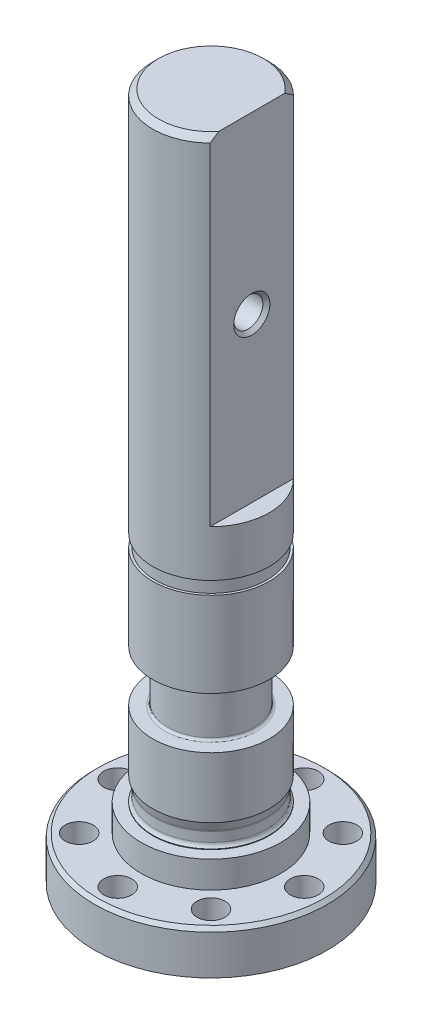
from build123d import *

# Parameters (mm, degrees)
SCHIZZO1_R                   = 10
SCHIZZO1_R_2                 = 1.2
ESTRUSIONE_ESTRUSIONE1_DEPTH = 6
SCHIZZO2_R                   = 5
ESTRUSIONE_ESTRUSIONE2_DEPTH = 53
SCHIZZO9_W                   = 4
SCHIZZO9_H                   = 2.3
SMUSSO3_SIZE                 = 0.3
FORO_8_1_8_1_1_D             = 8.1
FORO_8_1_8_1_1_DEPTH         = 2
FORO_8_1_8_1_1_TIP           = 2.433485507
SMUSSO5_SIZE                 = 0.5
TAGLIO_ESTRUSIONE1_START     = -29
TAGLIO_ESTRUSIONE1_DEPTH     = 29
PREFORO_DA_MASCHIARE_M3_1_D  = 2.5
SMUSSO4_SIZE                 = 0.3
FORO_8_1_8_1_2_D             = 8.1
FORO_8_1_8_1_2_DEPTH         = 2.5
FORO_8_1_8_1_2_TIP           = 2.433485507
SCHIZZO17_W                  = 1.3
SCHIZZO17_H                  = 4.4
RACCORDO1_R                  = 0.2
SCHIZZO18_W                  = 0.2
SCHIZZO18_H                  = 1.1


with BuildPart() as part:
    # Schizzo1 → Estrusione-Estrusione1 (new body)
    with BuildSketch(Plane(origin=(0, 0, 0), x_dir=(1, 0, 0), z_dir=(0, 1, 0))):
        with Locations(Location((0, 0, 0), (0, 0, 270))):
            Circle(SCHIZZO1_R)
        with Locations(Location((0, 8, 0), (0, 0, 270))):
            Circle(SCHIZZO1_R_2, mode=Mode.SUBTRACT)
        with Locations(Location((5.656854249, 5.656854249, 0), (0, 0, 270))):
            Circle(SCHIZZO1_R_2, mode=Mode.SUBTRACT)
        with Locations(Location((8, 0, 0), (0, 0, 270))):
            Circle(SCHIZZO1_R_2, mode=Mode.SUBTRACT)
        with Locations(Location((5.656854249, -5.656854249, 0), (0, 0, 270))):
            Circle(SCHIZZO1_R_2, mode=Mode.SUBTRACT)
        with Locations(Location((0, -8, 0), (0, 0, 270))):
            Circle(SCHIZZO1_R_2, mode=Mode.SUBTRACT)
        with Locations(Location((-5.656854249, -5.656854249, 0), (0, 0, 270))):
            Circle(SCHIZZO1_R_2, mode=Mode.SUBTRACT)
        with Locations(Location((-8, 0, 0), (0, 0, 270))):
            Circle(SCHIZZO1_R_2, mode=Mode.SUBTRACT)
        with Locations(Location((-5.656854249, 5.656854249, 0), (0, 0, 270))):
            Circle(SCHIZZO1_R_2, mode=Mode.SUBTRACT)
    extrude(amount=ESTRUSIONE_ESTRUSIONE1_DEPTH)

    # Schizzo2 → Estrusione-Estrusione2 (add)
    with BuildSketch(Plane(origin=(0, 6, 0), x_dir=(1, 0, 0), z_dir=(0, 1, 0))):
        with Locations(Location((0, 0, 0), (0, 0, 270))):
            Circle(SCHIZZO2_R)
    extrude(amount=ESTRUSIONE_ESTRUSIONE2_DEPTH)

    # Schizzo9 → Taglia-Rivoluzione3 (revolve, cut)
    with BuildSketch(Plane.XY, mode=Mode.PRIVATE) as taglia_rivoluzione3_sk:
        with Locations((-8, 4.85)):
            Rectangle(SCHIZZO9_W, SCHIZZO9_H)
    revolve(taglia_rivoluzione3_sk.sketch.rotate(Axis((0, 0, 0), (0, 1, 0)), 270), axis=Axis((0, 0, 0), (0, 1, 0)), mode=Mode.SUBTRACT)

    # Smusso3
    smusso3_edges = [part.edges().sort_by_distance(p)[0] for p in [
        (0, 3.7, -10),
    ]]
    chamfer(smusso3_edges, length=SMUSSO3_SIZE)

    # Schizzo4 → Taglia-Rivoluzione2 (revolve, cut)
    with BuildSketch(Plane.XY, mode=Mode.PRIVATE) as taglia_rivoluzione2_sk:
        with BuildLine():
            Line((-5, 8), (-4.813629669, 7.304456457))
            ThreePointArc((-4.813629669, 7.304456457), (-4.803422055, 7.253139316), (-4.8, 7.200928839))
            Line((-4.8, 7.200928839), (-4.8, 6.4))
            ThreePointArc((-4.8, 6.4), (-4.917157288, 6.117157288), (-5.2, 6))
            Line((-5.2, 6), (-7, 6))
            Line((-7, 6), (-7, 8))
            Line((-7, 8), (-5, 8))
        make_face()
    revolve(taglia_rivoluzione2_sk.sketch.rotate(Axis((0, 0, 0), (0, 1, 0)), 270), axis=Axis((0, 0, 0), (0, 1, 0)), mode=Mode.SUBTRACT)

    # Foro Ø8.1 (8.1)-1
    with Locations(Plane.XZ):
        with Locations((0, 0)):
            Hole(FORO_8_1_8_1_1_D / 2, depth=FORO_8_1_8_1_1_DEPTH)
            with Locations((0, 0, -(FORO_8_1_8_1_1_DEPTH + FORO_8_1_8_1_1_TIP / 2))):  # 118° drill point
                Cone(0, FORO_8_1_8_1_1_D / 2, FORO_8_1_8_1_1_TIP, mode=Mode.SUBTRACT)

    # Smusso5
    smusso5_edges = [part.edges().sort_by_distance(p)[0] for p in [
        (0, 59, -5),
    ]]
    chamfer(smusso5_edges, length=SMUSSO5_SIZE)

    # Schizzo10 → Taglio-Estrusione1 (cut)
    with BuildSketch(Plane(origin=(0, 59, 0), x_dir=(1, 0, 0), z_dir=(0, 1, 0)).offset(TAGLIO_ESTRUSIONE1_START)):
        with BuildLine():
            Line((3.5, -3.570714214), (3.5, 3.570714214))
            ThreePointArc((3.5, 3.570714214), (5, 0), (3.5, -3.570714214))
        make_face()
    extrude(amount=TAGLIO_ESTRUSIONE1_DEPTH, mode=Mode.SUBTRACT)

    # Preforo da maschiare M3-1 (through all)
    with Locations(Plane(origin=(3.5, 0, 0), x_dir=(0, 0, -1), z_dir=(1, 0, 0))):
        with Locations((0, 44)):
            Hole(PREFORO_DA_MASCHIARE_M3_1_D / 2)

    # Smusso4
    smusso4_edges = [part.edges().sort_by_distance(p)[0] for p in [
        (3.5, 44, -1.25),
    ]]
    chamfer(smusso4_edges, length=SMUSSO4_SIZE)

    # Foro Ø8.1 (8.1)-2
    with Locations(Plane.XZ):
        with Locations((0, 0)):
            Hole(FORO_8_1_8_1_2_D / 2, depth=FORO_8_1_8_1_2_DEPTH)
            with Locations((0, 0, -(FORO_8_1_8_1_2_DEPTH + FORO_8_1_8_1_2_TIP / 2))):  # 118° drill point
                Cone(0, FORO_8_1_8_1_2_D / 2, FORO_8_1_8_1_2_TIP, mode=Mode.SUBTRACT)

    # Schizzo17 → Taglia-Rivoluzione4 (revolve, cut)
    with BuildSketch(Plane.XY, mode=Mode.PRIVATE) as taglia_rivoluzione4_sk:
        with Locations((-4.35, 15.4)):
            Rectangle(SCHIZZO17_W, SCHIZZO17_H)
    revolve(taglia_rivoluzione4_sk.sketch.rotate(Axis((0, 0, 0), (0, 1, 0)), 270), axis=Axis((0, 0, 0), (0, 1, 0)), mode=Mode.SUBTRACT)

    # Raccordo1
    raccordo1_edges = [part.edges().sort_by_distance(p)[0] for p in [
        (0, 13.2, 3.7),
        (0, 17.6, 3.7),
    ]]
    fillet(raccordo1_edges, radius=RACCORDO1_R)

    # Schizzo18 → Taglia-Rivoluzione5 (revolve, cut)
    with BuildSketch(Plane.XY, mode=Mode.PRIVATE) as taglia_rivoluzione5_sk:
        with Locations((-4.9, 25.45)):
            Rectangle(SCHIZZO18_W, SCHIZZO18_H)
    revolve(taglia_rivoluzione5_sk.sketch.rotate(Axis((0, 0, 0), (0, 1, 0)), 270), axis=Axis((0, 0, 0), (0, 1, 0)), mode=Mode.SUBTRACT)


solid = part.part
